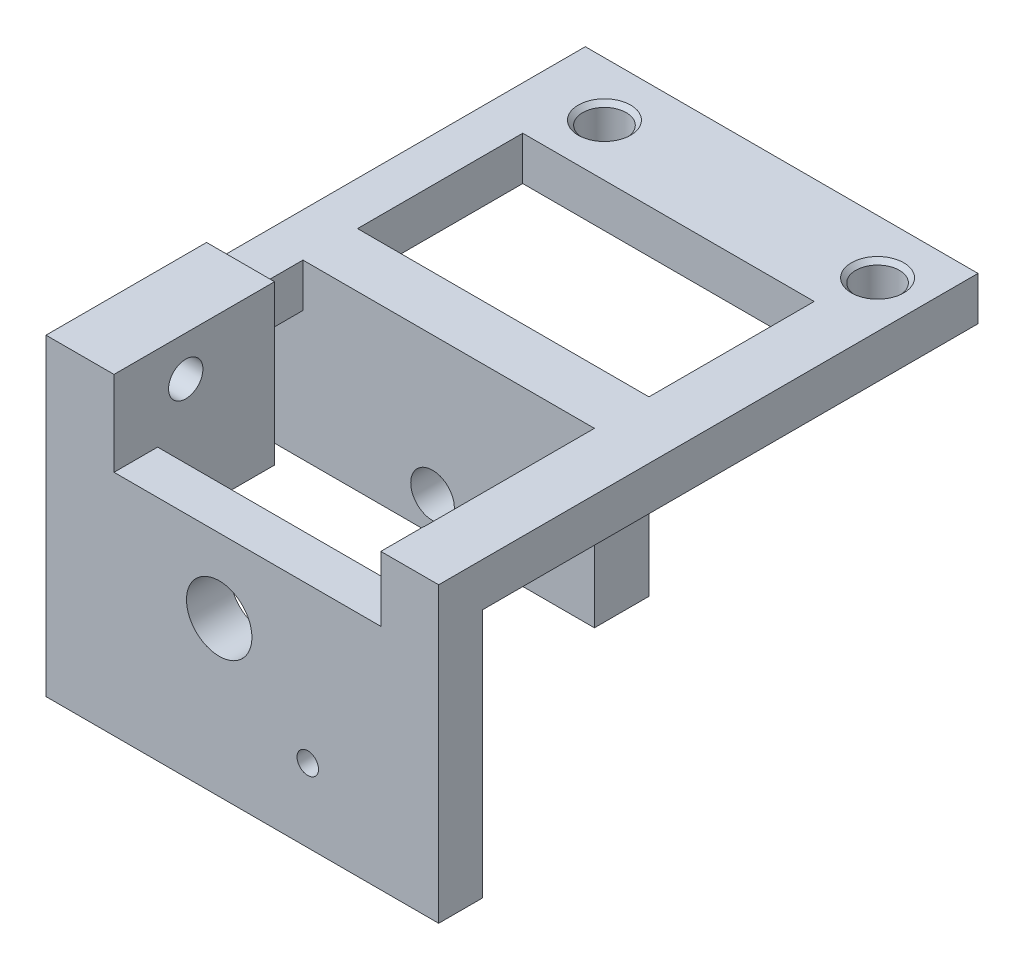
from build123d import *

# Parameters (mm, degrees)
SKETCH1_R                             = 1.561475409
SKETCH1_R_2                           = 4.762499999
BOSS_EXTRUDE1_DEPTH                   = 6.35
BOSS_EXTRUDE2_DEPTH                   = 23.368
SKETCH3_W                             = 6.35
SKETCH3_H                             = 76.2
SKETCH3_W_2                           = 8.382
BOSS_EXTRUDE3_DEPTH                   = 6.35
CUT_EXTRUDE1_REACH                    = 102.468
SKETCH4_R                             = 2.5
SKETCH5_W                             = 57.15
SKETCH5_H                             = 15.458350333
BOSS_EXTRUDE4_DEPTH                   = 6.35
F_1_4_0_25_DIAMETER_HOLE1_D           = 6.35
F_1_4_0_25_DIAMETER_HOLE1_CSINK_D     = 7.62
F_1_4_0_25_DIAMETER_HOLE1_CSINK_ANGLE = 90
SKETCH8_W                             = 48.768
SKETCH8_H                             = 7.9375
BOSS_EXTRUDE5_DEPTH                   = 25.146
CUT_EXTRUDE2_REACH                    = 62.02
SKETCH10_R                            = 3.175


with BuildPart() as part:
    # Sketch1 → Boss-Extrude1 (new body)
    with BuildSketch(Plane.XY):
        Polygon((23.52260518, 29.069744957), (31.942128684, 29.069744957), (31.942128684, -13.602255043), (-25.207871316, -13.602255043), (-25.207871316, 8.844196721), (-25.207871316, 31.958196721), (-18.857871316, 31.958196721), (-15.310946905, 31.958196721), (-15.310946905, 22.656471706), (-15.310946905, 19.620299994), (23.52260518, 19.620299994), (23.52260518, 22.656471706), align=None)
        with Locations((12.892128684, -2.934255043)):
            Circle(SKETCH1_R, mode=Mode.SUBTRACT)
        with Locations((6.7e-08, 8.844196721)):
            Circle(SKETCH1_R_2, mode=Mode.SUBTRACT)
    extrude(amount=-BOSS_EXTRUDE1_DEPTH)

    # Sketch2 → Boss-Extrude2 (add)
    with BuildSketch(Plane.XY):
        Polygon((-15.310946905, 31.958196721), (-18.857871316, 31.958196721), (-25.207871316, 31.958196721), (-25.207871316, 8.844196721), (-18.857871316, 8.844196721), (-15.310946905, 8.844196721), (-15.310946905, 19.620299994), align=None)
    extrude(amount=-BOSS_EXTRUDE2_DEPTH)

    # Sketch3 → Boss-Extrude3 (add)
    with BuildSketch(Plane(origin=(0, 29.069744957, 0), x_dir=(1, 0, 0), z_dir=(0, 1, 0))):
        with Locations((-22.032871316, 38.1)):
            Rectangle(SKETCH3_W, SKETCH3_H)
        with Locations((27.751128684, 38.1)):
            Rectangle(SKETCH3_W_2, SKETCH3_H)
    extrude(amount=-BOSS_EXTRUDE3_DEPTH)

    # Sketch4 → Cut-Extrude1 (cut, up to next)
    with BuildSketch(Plane.ZY.offset(25.207871316), mode=Mode.PRIVATE) as cut_extrude1_sk1:
        with Locations(Location((-10.437499124, 26.162307082, 0), (0, 0, 270))):
            Circle(SKETCH4_R)
    cut_extrude1_tool1 = extrude(cut_extrude1_sk1.sketch, amount=-CUT_EXTRUDE1_REACH, mode=Mode.PRIVATE) & part.part
    add(cut_extrude1_tool1.solids().sort_by_distance((-25.207871, 26.162307, -10.437499))[0], mode=Mode.SUBTRACT)

    # Sketch5 → Boss-Extrude4 (add)
    with BuildSketch(Plane(origin=(0, 29.069744957, 0), x_dir=(1, 0, 0), z_dir=(0, 1, 0))):
        with Locations((3.367128684, 70.765431119)):
            Rectangle(SKETCH5_W, SKETCH5_H)
    extrude(amount=-BOSS_EXTRUDE4_DEPTH)

    # 1/4 (0.25) Diameter Hole1 (through all)
    with Locations(Plane(origin=(0, 29.069744957, 0), x_dir=(1, 0, 0), z_dir=(0, 1, 0))):
        with Locations((-14.553595262, 70.62526945), (25.19519669, 70.62526945)):
            CounterSinkHole(F_1_4_0_25_DIAMETER_HOLE1_D / 2, F_1_4_0_25_DIAMETER_HOLE1_CSINK_D / 2, counter_sink_angle=F_1_4_0_25_DIAMETER_HOLE1_CSINK_ANGLE)

    # Sketch8 → Boss-Extrude5 (add)
    with BuildSketch(Plane(origin=(0, 29.069744957, 0), x_dir=(1, 0, 0), z_dir=(0, 1, 0))):
        with Locations((-0.823871316, 35.01875)):
            Rectangle(SKETCH8_W, SKETCH8_H)
    extrude(amount=-BOSS_EXTRUDE5_DEPTH)

    # Sketch10 → Cut-Extrude2 (cut, up to next)
    with BuildSketch(Plane(origin=(0, 0, -38.9875), x_dir=(-1, 0, 0), z_dir=(0, 0, -1)), mode=Mode.PRIVATE) as cut_extrude2_sk1:
        with Locations((-6.7e-08, 8.844196721)):
            Circle(SKETCH10_R)
    cut_extrude2_tool1 = extrude(cut_extrude2_sk1.sketch, amount=-CUT_EXTRUDE2_REACH, mode=Mode.PRIVATE) & part.part
    add(cut_extrude2_tool1.solids().sort_by_distance((0, 8.844197, -38.9875))[0], mode=Mode.SUBTRACT)


solid = part.part
